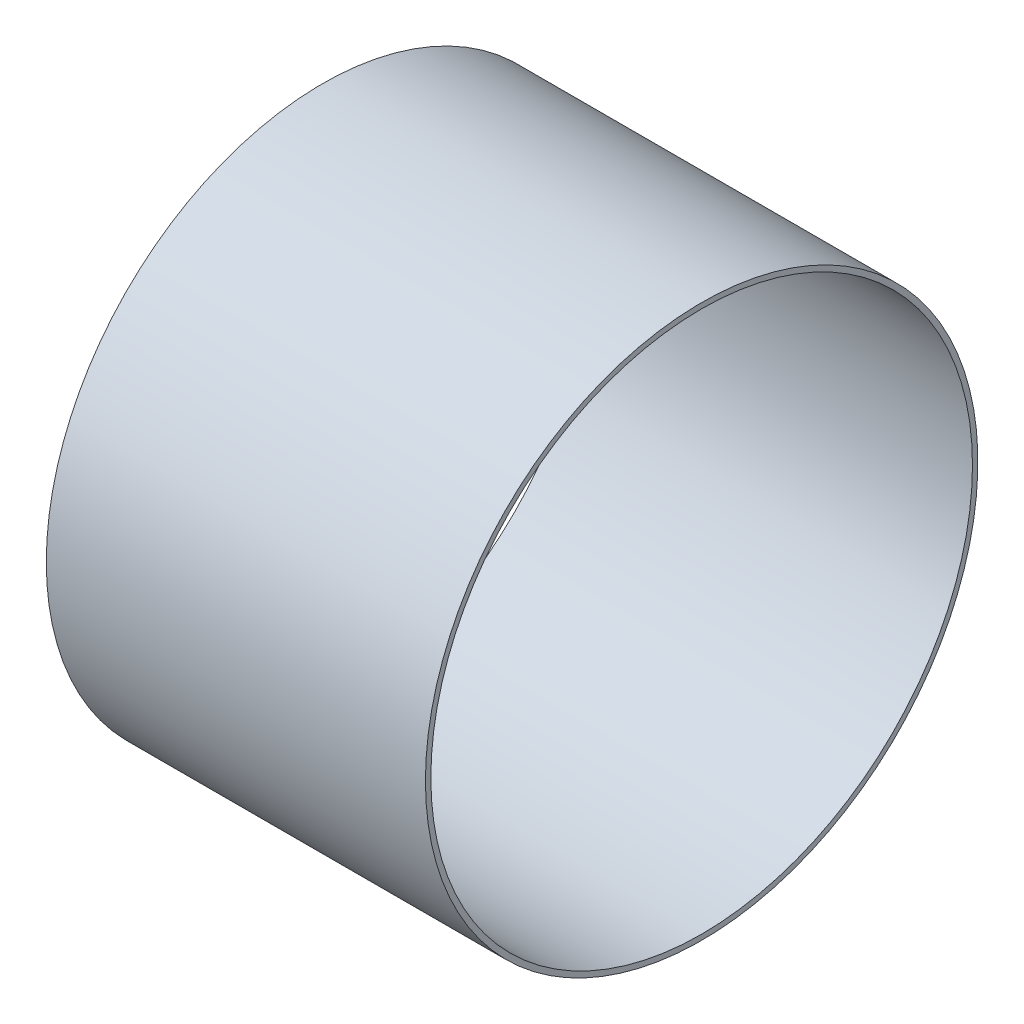
from build123d import *

# Parameters (mm, degrees)
SKETCH_1_W = 140
SKETCH_1_H = 2


with BuildPart() as part:
    # Эскиз1 → Повернуть1 (revolve)
    with BuildSketch(Plane.XY):
        with Locations((0, 101)):
            Rectangle(SKETCH_1_W, SKETCH_1_H)
    revolve(axis=Axis((0, 0, 0), (1, 0, 0)))


solid = part.part
